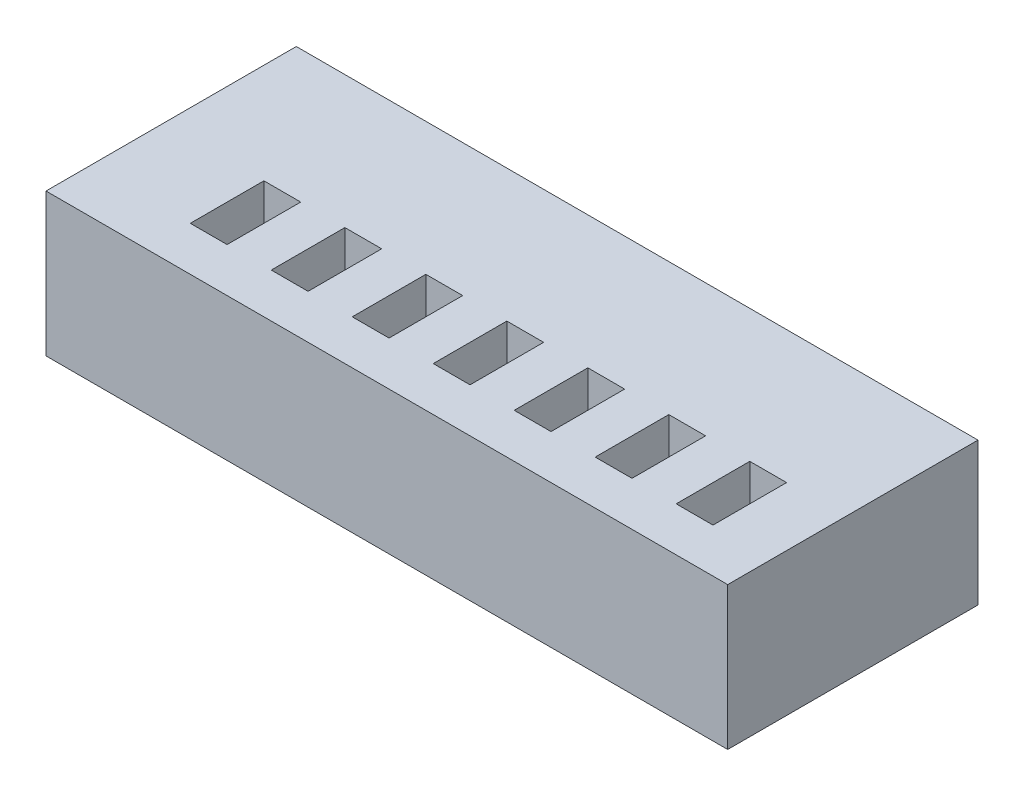
from build123d import *

# Parameters (mm, degrees)
SKETCH1_W           = 117.602
SKETCH1_H           = 43.18
BOSS_EXTRUDE1_DEPTH = 12.319
SKETCH2_W           = 6.35
SKETCH2_H           = 12.7
CUT_EXTRUDE1_DEPTH  = 12.7
SKETCH3_W           = 30.280505476
SKETCH3_H           = 7.594186668
CUT_EXTRUDE2_DEPTH  = 12.7


with BuildPart() as part:
    # Sketch1 → Boss-Extrude1 (new, symmetric)
    with BuildSketch(Plane(origin=(0, 0, 0), x_dir=(1, 0, 0), z_dir=(0, 1, 0))):
        Rectangle(SKETCH1_W, SKETCH1_H)
    extrude(amount=BOSS_EXTRUDE1_DEPTH, both=True)

    # Sketch2 → Cut-Extrude1 (cut)
    with BuildSketch(Plane(origin=(0, 12.319, 0), x_dir=(1, 0, 0), z_dir=(0, 1, 0))):
        with Locations((45.466, -7.62)):
            Rectangle(SKETCH2_W, SKETCH2_H)
        with Locations((31.496, -7.62)):
            Rectangle(SKETCH2_W, SKETCH2_H)
        with Locations((17.526, -7.62)):
            Rectangle(SKETCH2_W, SKETCH2_H)
        with Locations((3.556, -7.62)):
            Rectangle(SKETCH2_W, SKETCH2_H)
        with Locations((-10.414, -7.62)):
            Rectangle(SKETCH2_W, SKETCH2_H)
        with Locations((-24.384, -7.62)):
            Rectangle(SKETCH2_W, SKETCH2_H)
        with Locations((-38.354, -7.62)):
            Rectangle(SKETCH2_W, SKETCH2_H)
    extrude(amount=-CUT_EXTRUDE1_DEPTH, mode=Mode.SUBTRACT)

    # Sketch3 → Cut-Extrude2 (cut)
    with BuildSketch(Plane.ZY.offset(58.801)):
        Rectangle(SKETCH3_W, SKETCH3_H)
    extrude(amount=-CUT_EXTRUDE2_DEPTH, mode=Mode.SUBTRACT)


solid = part.part
